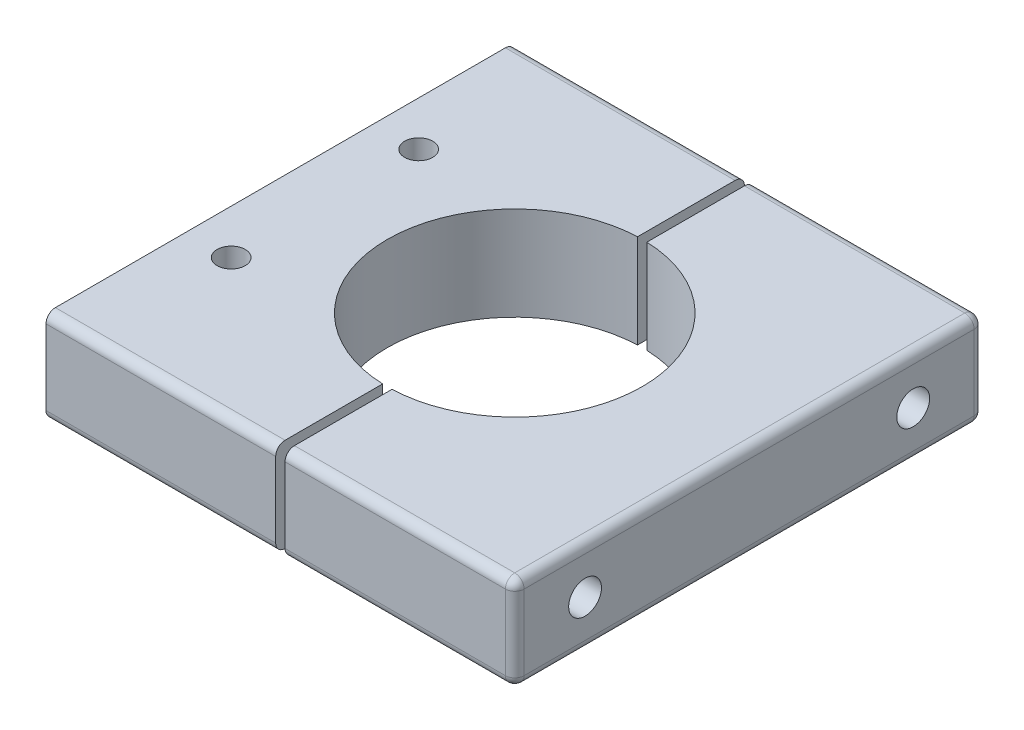
from build123d import *

# Parameters (mm, degrees)
ESQUISSE1_W             = 49
ESQUISSE1_H             = 100
BOSS_EXTRU_1_DEPTH      = 20
ESQUISSE2_W             = 49
ESQUISSE2_H             = 100
BOSS_EXTRU_2_DEPTH      = 20
ESQUISSE3_R             = 27.2
ENL_V_MAT_EXTRU_1_DEPTH = 76.056920996
ESQUISSE4_R             = 3.5
ENL_V_MAT_EXTRU_2_DEPTH = 115.60166399
ESQUISSE5_R             = 3
ENL_V_MAT_EXTRU_3_DEPTH = 76.056920996
ENL_V_MAT_EXTRU_5_DEPTH = 5
CONG_1_R                = 2
CONG_2_R                = 2


with BuildPart() as part:
    # Esquisse1 → Boss.-Extru.1 (new body)
    with BuildSketch(Plane(origin=(0, 0, 0), x_dir=(1, 0, 0), z_dir=(0, 1, 0))):
        with Locations((25.5, -2.283280209)):
            Rectangle(ESQUISSE1_W, ESQUISSE1_H)
    extrude(amount=BOSS_EXTRU_1_DEPTH)


with BuildPart() as body_2:
    # Esquisse2 → Boss.-Extru.2 (new body)
    with BuildSketch(Plane(origin=(0, 0, 0), x_dir=(1, 0, 0), z_dir=(0, 1, 0))):
        with Locations((-25.5, -2.283280209)):
            Rectangle(ESQUISSE2_W, ESQUISSE2_H)
    extrude(amount=BOSS_EXTRU_2_DEPTH)


with BuildPart() as enl_v_mat_extru_1_tool:
    # Esquisse3 → Enlèv. mat.-Extru.1 (new, through all)
    with BuildSketch(Plane(origin=(0, 20, 0), x_dir=(1, 0, 0), z_dir=(0, 1, 0))):
        with Locations((0, -2.283280209)):
            Circle(ESQUISSE3_R)
    extrude(amount=-ENL_V_MAT_EXTRU_1_DEPTH)


with BuildPart() as part_1:
    add(part.part)

    # Enlèv. mat.-Extru.1: cut by enl_v_mat_extru_1_tool
    add(enl_v_mat_extru_1_tool.part, mode=Mode.SUBTRACT)


with BuildPart() as body_2_1:
    add(body_2.part)

    # Enlèv. mat.-Extru.1: cut by enl_v_mat_extru_1_tool
    add(enl_v_mat_extru_1_tool.part, mode=Mode.SUBTRACT)


with BuildPart() as enl_v_mat_extru_2_tool:
    # Esquisse4 → Enlèv. mat.-Extru.2 (new, through all)
    with BuildSketch(Plane.ZY.offset(50)):
        with Locations((-32.716719791, 10)):
            Circle(ESQUISSE4_R)
        with Locations((37.283280209, 10)):
            Circle(ESQUISSE4_R)
    extrude(amount=-ENL_V_MAT_EXTRU_2_DEPTH)


with BuildPart() as part_2:
    add(part_1.part)

    # Enlèv. mat.-Extru.2: cut by enl_v_mat_extru_2_tool
    add(enl_v_mat_extru_2_tool.part, mode=Mode.SUBTRACT)

    # Congé2
    cong_2_edges = [part_2.edges().sort_by_distance(p)[0] for p in [
        (50, 20, 2.283280209),
        (25.5, 20, -47.716719791),
        (25.5, 0, -47.716719791),
        (50, 0, 2.283280209),
        (25.5, 0, 52.283280209),
        (25.5, 20, 52.283280209),
        (50, 10, -47.716719791),
        (50, 10, 52.283280209),
    ]]
    fillet(cong_2_edges, radius=CONG_2_R)


with BuildPart() as body_2_2:
    add(body_2_1.part)

    # Enlèv. mat.-Extru.2: cut by enl_v_mat_extru_2_tool
    add(enl_v_mat_extru_2_tool.part, mode=Mode.SUBTRACT)

    # Esquisse5 → Enlèv. mat.-Extru.3 (cut, through all)
    with BuildSketch(Plane(origin=(0, 20, 0), x_dir=(1, 0, 0), z_dir=(0, 1, 0))):
        with Locations(Location((-40.5, 17.716719791, 0), (0, 0, 270))):
            Circle(ESQUISSE5_R)
        with Locations(Location((-40.5, -22.283280209, 0), (0, 0, 270))):
            Circle(ESQUISSE5_R)
    extrude(amount=-ENL_V_MAT_EXTRU_3_DEPTH, mode=Mode.SUBTRACT)

    # Esquisse7 → Enlèv. mat.-Extru.5 (cut)
    with BuildSketch(Plane.ZY.offset(50)):
        Polygon((-26.964408073, 6.921974135), (-27.174915339, 13.442635146), (-32.927227058, 16.520661011), (-38.46903151, 13.078025865), (-38.258524244, 6.557364854), (-32.506212525, 3.479338989), align=None)
        Polygon((37.283280209, 3.475941958), (42.933280209, 6.737970979), (42.933280209, 13.262029021), (37.283280209, 16.524058042), (31.633280209, 13.262029021), (31.633280209, 6.737970979), align=None)
    extrude(amount=-ENL_V_MAT_EXTRU_5_DEPTH, mode=Mode.SUBTRACT)

    # Congé1
    cong_1_edges = [body_2_2.edges().sort_by_distance(p)[0] for p in [
        (-25.5, 20, 52.283280209),
        (-25.5, 20, -47.716719791),
        (-25.5, 0, 52.283280209),
        (-25.5, 0, -47.716719791),
    ]]
    fillet(cong_1_edges, radius=CONG_1_R)


solid = Compound([part_2.part, body_2_2.part])
